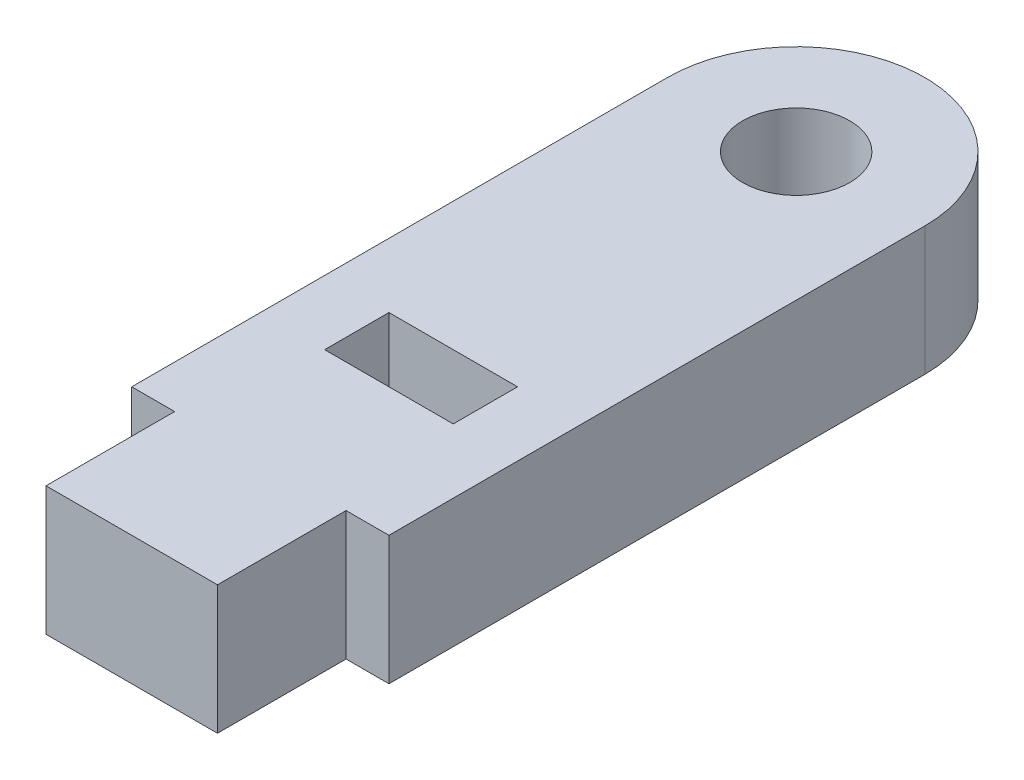
from build123d import *

# Parameters (mm, degrees)
SKETCH1_R           = 2.5
SKETCH1_W           = 6
SKETCH1_H           = 3
BOSS_EXTRUDE1_DEPTH = 6


with BuildPart() as part:
    # Sketch1 → Boss-Extrude1 (new body)
    with BuildSketch(Plane(origin=(0, 0, 0), x_dir=(1, 0, 0), z_dir=(0, 1, 0))):
        with BuildLine():
            Line((-6, 0), (-6, -25))
            Line((-6, -25), (-4, -25))
            Line((-4, -25), (-4, -31))
            Line((-4, -31), (4, -31))
            Line((4, -31), (4, -25))
            Line((4, -25), (6, -25))
            Line((6, -25), (6, 0))
            ThreePointArc((6, 0), (0, 6), (-6, 0))
        make_face()
        with Locations(Location((0, 0, 0), (0, 0, 270))):
            Circle(SKETCH1_R, mode=Mode.SUBTRACT)
        with Locations((0, -17.5)):
            Rectangle(SKETCH1_W, SKETCH1_H, mode=Mode.SUBTRACT)
    extrude(amount=BOSS_EXTRUDE1_DEPTH)


solid = part.part
